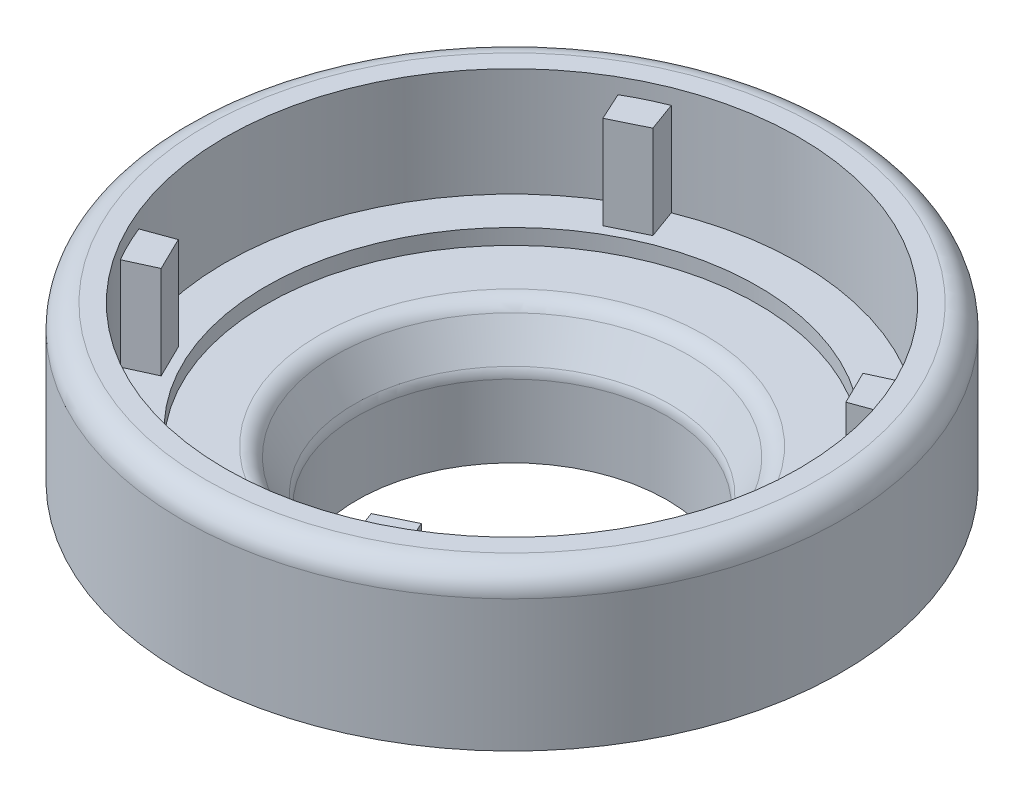
from build123d import *

# Parameters (mm, degrees)
SKETCH1_R               = 12
BOSS_EXTRUDE1_DEPTH     = 5
SKETCH2_R               = 12.5
BOSS_EXTRUDE2_DEPTH     = 1
SKETCH6_R               = 21.25
SKETCH6_R_2             = 18.5
SKETCH6_R_3             = 12.5
BOSS_EXTRUDE7_DEPTH     = 3
SKETCH6_3_R             = 21.25
SKETCH6_3_R_2           = 18.5
BOSS_EXTRUDE8_DEPTH     = 10
CUT_EXTRUDE2_DEPTH      = 35.045924866
CUT_EXTRUDE2_DEPTH_BACK = 35.045924866
SKETCH7_R               = 10
BOSS_EXTRUDE9_DEPTH     = 6
CIRPATTERN1_COUNT       = 4
SKETCH10_R              = 15.862399731
CUT_EXTRUDE3_DEPTH      = 1
CHAMFER1_SIZE           = 3
CHAMFER1_SIZE2          = 1.732050808
CHAMFER2_SIZE           = 0.7
CHAMFER2_SIZE2          = 1.435212689
FILLET1_R               = 1.2
FILLET2_R               = 1.5


with BuildPart() as part:
    # Sketch1 → Boss-Extrude1 (new body)
    with BuildSketch(Plane(origin=(0, 0, 0), x_dir=(1, 0, 0), z_dir=(0, 1, 0))):
        with Locations(Location((0, 0, 0), (0, 0, 270))):
            Circle(SKETCH1_R)
    extrude(amount=BOSS_EXTRUDE1_DEPTH)

    # Sketch2 → Boss-Extrude2 (add)
    with BuildSketch(Plane(origin=(0, 5, 0), x_dir=(1, 0, 0), z_dir=(0, 1, 0))):
        with Locations(Location((0, 0, 0), (0, 0, 270))):
            Circle(SKETCH2_R)
    extrude(amount=BOSS_EXTRUDE2_DEPTH)

    # Sketch6 → Boss-Extrude7 (add)
    # profile 1 of 3: a face of its own
    with BuildSketch(Plane(origin=(0, 6, 0), x_dir=(1, 0, 0), z_dir=(0, 1, 0))):
        with Locations(Location((0, 0, 0), (0, 0, 270))):
            Circle(SKETCH6_R)
        Circle(SKETCH6_R_2, mode=Mode.SUBTRACT)
    # profile 2 of 3: a face of its own
    with BuildSketch(Plane(origin=(0, 6, 0), x_dir=(1, 0, 0), z_dir=(0, 1, 0))):
        Circle(SKETCH6_R_2)
        with Locations(Location((0, 0, 0), (0, 0, 270))):
            Circle(SKETCH6_R_3, mode=Mode.SUBTRACT)
    # profile 3 of 3: a face of its own
    with BuildSketch(Plane(origin=(0, 6, 0), x_dir=(1, 0, 0), z_dir=(0, 1, 0))):
        with Locations(Location((0, 0, 0), (0, 0, 270))):
            Circle(SKETCH6_R_3)
    extrude(amount=BOSS_EXTRUDE7_DEPTH)

    # Sketch6<3> → Boss-Extrude8 (add)
    with BuildSketch(Plane(origin=(0, 6, 0), x_dir=(1, 0, 0), z_dir=(0, 1, 0))):
        with Locations(Location((0, 0, 0), (0, 0, 270))):
            Circle(SKETCH6_3_R)
        with Locations(Location((0, 0, 0), (0, 0, 270))):
            Circle(SKETCH6_3_R_2, mode=Mode.SUBTRACT)
    extrude(amount=BOSS_EXTRUDE8_DEPTH)

    # Sketch7 → Cut-Extrude2 (cut, two sides: drawn at the far end of the back side and taken through both)
    with BuildSketch(Plane.XZ.offset(-CUT_EXTRUDE2_DEPTH_BACK)):
        with Locations(Location((0, 0, 0), (0, 0, 90))):
            Circle(SKETCH7_R)
    extrude(amount=CUT_EXTRUDE2_DEPTH + CUT_EXTRUDE2_DEPTH_BACK, mode=Mode.SUBTRACT)

    # Sketch8 → Boss-Extrude9 (add)
    with BuildSketch(Plane(origin=(0, 9, 0), x_dir=(1, 0, 0), z_dir=(0, 1, 0))):
        with BuildLine():
            Line((17.165020759, 6.900149443), (15.300741035, 6.221944311))
            Line((15.300741035, 6.221944311), (14.239421514, 8.386472924))
            Line((14.239421514, 8.386472924), (16.043145314, 9.212355205))
            ThreePointArc((16.043145314, 9.212355205), (16.652877744, 8.079927373), (17.165020759, 6.900149443))
        make_face()
    boss_extrude9 = extrude(amount=BOSS_EXTRUDE9_DEPTH)

    # CirPattern1: Boss-Extrude9 ×4 about axis
    cirpattern1_axis = Axis((0, 0, 0), (0, 1, 0))
    for i in range(1, CIRPATTERN1_COUNT):
        add(boss_extrude9.rotate(cirpattern1_axis, i * 360 / CIRPATTERN1_COUNT))

    # Sketch10 → Cut-Extrude3 (cut)
    with BuildSketch(Plane(origin=(0, 9, 0), x_dir=(1, 0, 0), z_dir=(0, 1, 0))):
        with Locations(Location((0, 0, 0), (0, 0, 270))):
            Circle(SKETCH10_R)
    extrude(amount=-CUT_EXTRUDE3_DEPTH, mode=Mode.SUBTRACT)

    # Chamfer1
    chamfer1_edges = [part.edges().sort_by_distance(p)[0] for p in [
        (0, 8, -10),
    ]]
    chamfer1_side = [part.faces().sort_by_distance(p)[0] for p in [
        (0, 4, -10),
    ]]
    chamfer(chamfer1_edges, length=CHAMFER1_SIZE, length2=CHAMFER1_SIZE2, reference=chamfer1_side[0])

    # Chamfer2
    chamfer2_edges = [part.edges().sort_by_distance(p)[0] for p in [
        (0, 6, -12.5),
    ]]
    chamfer2_side = [part.faces().sort_by_distance(p)[0] for p in [
        (0, 5.5, -12.5),
    ]]
    chamfer(chamfer2_edges, length=CHAMFER2_SIZE, length2=CHAMFER2_SIZE2, reference=chamfer2_side[0])

    # Fillet1
    fillet1_edges = [part.edges().sort_by_distance(p)[0] for p in [
        (0, 8, -11.732050808),
        (0, 5, -10),
    ]]
    fillet(fillet1_edges, radius=FILLET1_R)

    # Fillet2
    fillet2_edges = [part.edges().sort_by_distance(p)[0] for p in [
        (0, 16, -21.25),
    ]]
    fillet(fillet2_edges, radius=FILLET2_R)


solid = part.part
